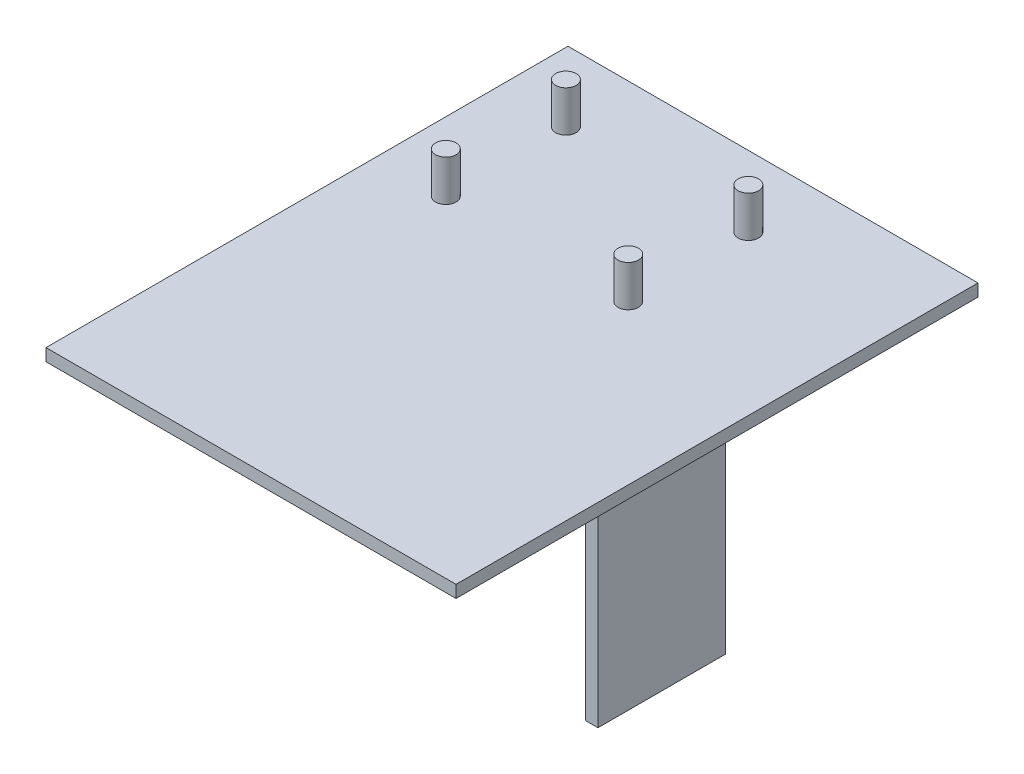
from build123d import *

# Parameters (mm, degrees)
CROQUIS1_W              = 100
CROQUIS1_H              = 127.304752994
SALIENTE_EXTRUIR1_DEPTH = 3
CROQUIS2_W              = 3
CROQUIS2_H              = 31.14357053
SALIENTE_EXTRUIR2_DEPTH = 60
CROQUIS3_R              = 2.5
SALIENTE_EXTRUIR3_DEPTH = 10


with BuildPart() as part:
    # Croquis1 → Saliente-Extruir1 (new body)
    with BuildSketch(Plane(origin=(0, 0, 0), x_dir=(1, 0, 0), z_dir=(0, 1, 0))):
        Rectangle(CROQUIS1_W, CROQUIS1_H)
    extrude(amount=SALIENTE_EXTRUIR1_DEPTH)

    # Croquis2 → Saliente-Extruir2 (add)
    with BuildSketch(Plane.XZ):
        with Locations((33.110839978, -1.924439839)):
            Rectangle(CROQUIS2_W, CROQUIS2_H)
    extrude(amount=SALIENTE_EXTRUIR2_DEPTH)

    # Croquis3 → Saliente-Extruir3 (add)
    with BuildSketch(Plane(origin=(0, 3, 0), x_dir=(1, 0, 0), z_dir=(0, 1, 0))):
        with Locations(Location((11.26131509, 46.378735673, 0), (0, 0, 270))):
            Circle(CROQUIS3_R)
        with Locations(Location((11.26131509, 17.087366944, 0), (0, 0, 270))):
            Circle(CROQUIS3_R)
        with Locations(Location((-33.233745319, 17.087366944, 0), (0, 0, 270))):
            Circle(CROQUIS3_R)
        with Locations(Location((-33.233745319, 46.378735673, 0), (0, 0, 270))):
            Circle(CROQUIS3_R)
    extrude(amount=SALIENTE_EXTRUIR3_DEPTH)


solid = part.part
